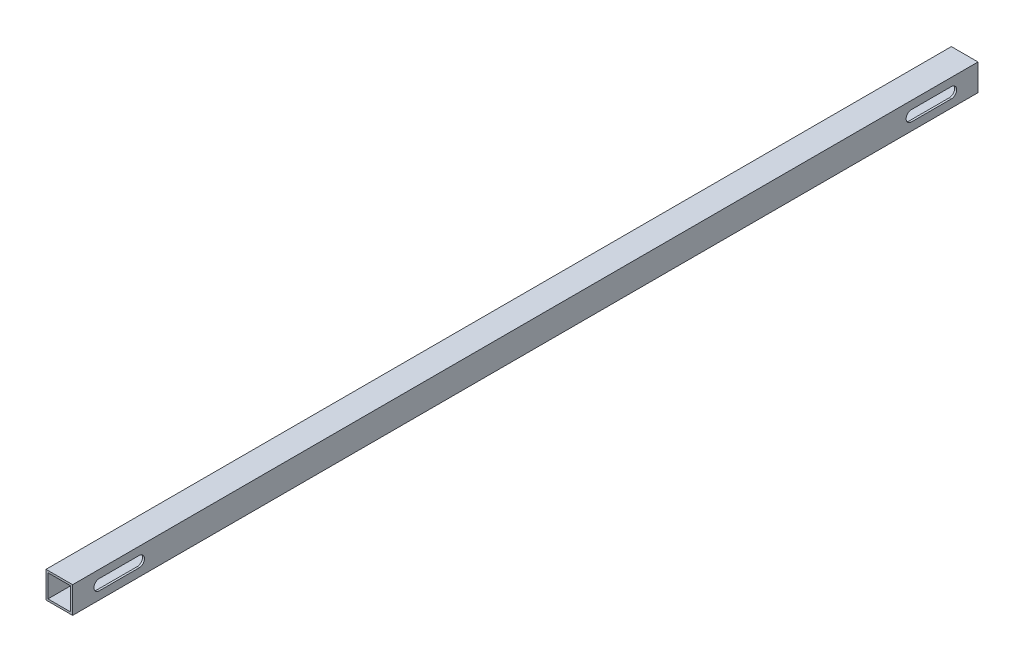
from build123d import *

# Parameters (mm, degrees)
SKETCH_1_W          = 20
SKETCH_1_H          = 20
SKETCH_1_W_2        = 17
SKETCH_1_H_2        = 17
EXTRUDE_1_DEPTH     = 680
CUT_EXTRUDE_1_DEPTH = 681.367547727


with BuildPart() as part:
    # ｽｹｯﾁ1 → ﾎﾞｽ - 押し出し1 (new body)
    with BuildSketch(Plane.XY):
        Rectangle(SKETCH_1_W, SKETCH_1_H)
        Rectangle(SKETCH_1_W_2, SKETCH_1_H_2, mode=Mode.SUBTRACT)
    extrude(amount=EXTRUDE_1_DEPTH)

    # ｽｹｯﾁ2 → ｶｯﾄ - 押し出し1 (cut, through all)
    with BuildSketch(Plane.ZY.offset(10)):
        with BuildLine():
            Line((660, -4), (630, -4))
            ThreePointArc((630, -4), (626, 0), (630, 4))
            Line((630, 4), (660, 4))
            ThreePointArc((660, 4), (664, 0), (660, -4))
        make_face()
        with BuildLine():
            Line((20, -4), (50, -4))
            ThreePointArc((50, -4), (54, 0), (50, 4))
            Line((50, 4), (20, 4))
            ThreePointArc((20, 4), (16, 0), (20, -4))
        make_face()
    extrude(amount=-CUT_EXTRUDE_1_DEPTH, mode=Mode.SUBTRACT)


solid = part.part
